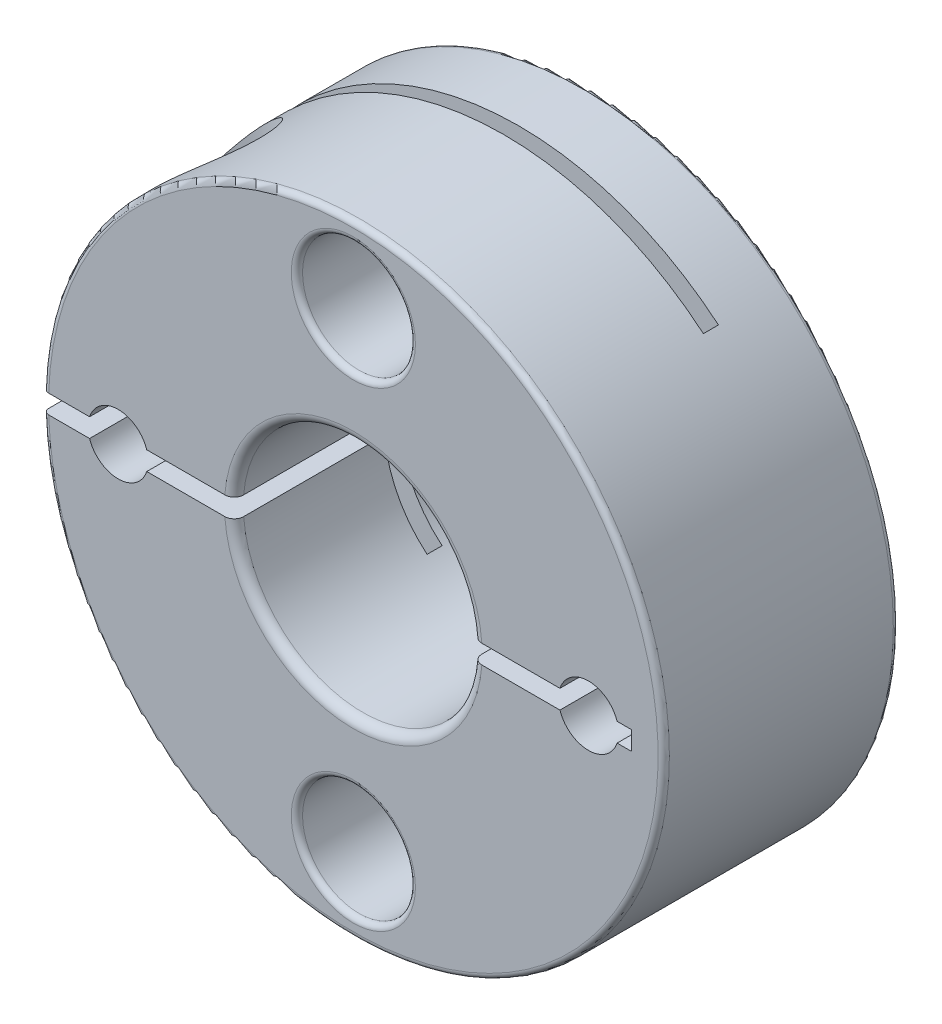
from build123d import *

# Parameters (mm, degrees)
SKETCH1_R           = 16.5
BOSS_EXTRUDE1_DEPTH = 12.5
CUT_EXTRUDE21_DEPTH = 0.8
SKETCH4_R           = 6.35
CUT_EXTRUDE2_DEPTH  = 27.471682984
FILLET3_R           = 0.5
CUT_EXTRUDE11_DEPTH = 0.5
SKETCH5_R           = 3
CUT_EXTRUDE4_DEPTH  = 27.471683031
TAP1_D              = 2.459
TAP1_DEPTH          = 4
TAP1_TIP            = 0.738758131
SKETCH9_R           = 3
CUT_EXTRUDE6_DEPTH  = 30.133314307
SKETCH11_R          = 1.6
CUT_EXTRUDE7_DEPTH  = 4.5
TAP2_D              = 2.459
FILLET1_R           = 0.3
FILLET2_R           = 0.3
FILLET4_R           = 0.1
SKETCH16_R          = 1.6
CUT_EXTRUDE24_DEPTH = 25.834452043


with BuildPart() as part:
    # Sketch1 → Boss-Extrude1 (new body)
    with BuildSketch(Plane.XY):
        Circle(SKETCH1_R)
    extrude(amount=BOSS_EXTRUDE1_DEPTH)

    # Sketch2 → Cut-Extrude21 (cut)
    with BuildSketch(Plane(origin=(0, 0, 3.7), x_dir=(-1, 0, 0), z_dir=(0, 0, -1))):
        with BuildLine():
            Line((-10.60599556, 12.639733311), (10.60599556, -12.639733311))
            ThreePointArc((10.60599556, -12.639733311), (12.639733311, 10.60599556), (-10.60599556, 12.639733311))
        make_face()
    extrude(amount=-CUT_EXTRUDE21_DEPTH, mode=Mode.SUBTRACT)

    # Sketch4 → Cut-Extrude2 (cut, through all)
    with BuildSketch(Plane.XY.offset(12.5)):
        Circle(SKETCH4_R)
    extrude(amount=-CUT_EXTRUDE2_DEPTH, mode=Mode.SUBTRACT)

    # Fillet3
    fillet3_edges = [part.edges().sort_by_distance(p)[0] for p in [
        (-6.35, 0, 0),
        (-6.35, 0, 12.5),
    ]]
    fillet(fillet3_edges, radius=FILLET3_R)

    # Sketch3 → Cut-Extrude11 (cut, symmetric)
    with BuildSketch(Plane(origin=(0, 0, 0), x_dir=(1, 0, 0), z_dir=(0, 1, 0))):
        with BuildLine():
            Line((0, -4.5), (-16.5, -4.5))
            Line((-16.5, -4.5), (-16.5, -12.5))
            Line((-16.5, -12.5), (14.781858905, -12.5))
            ThreePointArc((14.781858905, -12.5), (8.198241617, -7.613289249), (0, -7.500183374))
            Line((0, -7.500183374), (0, -4.5))
        make_face()
    extrude(amount=CUT_EXTRUDE11_DEPTH, both=True, mode=Mode.SUBTRACT)

    # Sketch5 → Cut-Extrude4 (cut, through all)
    with BuildSketch(Plane(origin=(0, 0, 0), x_dir=(-1, 0, 0), z_dir=(0, 0, -1))):
        with Locations((0, 12.5)):
            Circle(SKETCH5_R)
        with Locations((0, -12.5)):
            Circle(SKETCH5_R)
    extrude(amount=-CUT_EXTRUDE4_DEPTH, mode=Mode.SUBTRACT)

    # Tap1
    with Locations(Plane(origin=(0, 0, 0), x_dir=(-1, 0, 0), z_dir=(0, 0, -1))):
        with Locations((-12.5, 0), (12.5, 0)):
            Hole(TAP1_D / 2, depth=TAP1_DEPTH)
            with Locations((0, 0, -(TAP1_DEPTH + TAP1_TIP / 2))):  # 118° drill point
                Cone(0, TAP1_D / 2, TAP1_TIP, mode=Mode.SUBTRACT)

    # Sketch9 → Cut-Extrude6 (cut, through all)
    with BuildSketch(Plane(origin=(0, 4, 0), x_dir=(1, 0, 0), z_dir=(0, 1, 0))):
        with Locations((-12, -8.5)):
            Circle(SKETCH9_R)
    extrude(amount=CUT_EXTRUDE6_DEPTH, mode=Mode.SUBTRACT)

    # Sketch11 → Cut-Extrude7 (cut)
    with BuildSketch(Plane(origin=(0, 4, 0), x_dir=(1, 0, 0), z_dir=(0, 1, 0))):
        with Locations((-12, -8.5)):
            Circle(SKETCH11_R)
    extrude(amount=-CUT_EXTRUDE7_DEPTH, mode=Mode.SUBTRACT)

    # Tap2 (through all)
    with Locations(Plane(origin=(0, 0, 0), x_dir=(1, 0, 0), z_dir=(0, 1, 0))):
        with Locations((-12, -8.5)):
            Hole(TAP2_D / 2)

    # Fillet1
    fillet1_edges = [part.edges().sort_by_distance(p)[0] for p in [
        (3, -12.5, 12.5),
        (3, 12.5, 12.5),
    ]]
    fillet(fillet1_edges, radius=FILLET1_R)

    # Fillet2
    fillet2_edges = [part.edges().sort_by_distance(p)[0] for p in [
        (-16.5, 0, 0),
        (0.250028708, 16.498105517, 12.5),
    ]]
    fillet(fillet2_edges, radius=FILLET2_R)

    # Fillet4
    fillet4_edges = [part.edges().sort_by_distance(p)[0] for p in [
        (-13.6, 4, 8.5),
    ]]
    fillet(fillet4_edges, radius=FILLET4_R)

    # Sketch16 → Cut-Extrude24 (cut, through all)
    with BuildSketch(Plane(origin=(0, 0, 4), x_dir=(-1, 0, 0), z_dir=(0, 0, -1))):
        with Locations((12.5, 0)):
            Circle(SKETCH16_R)
        with Locations((-12.5, 0)):
            Circle(SKETCH16_R)
    extrude(amount=-CUT_EXTRUDE24_DEPTH, mode=Mode.SUBTRACT)


solid = part.part
